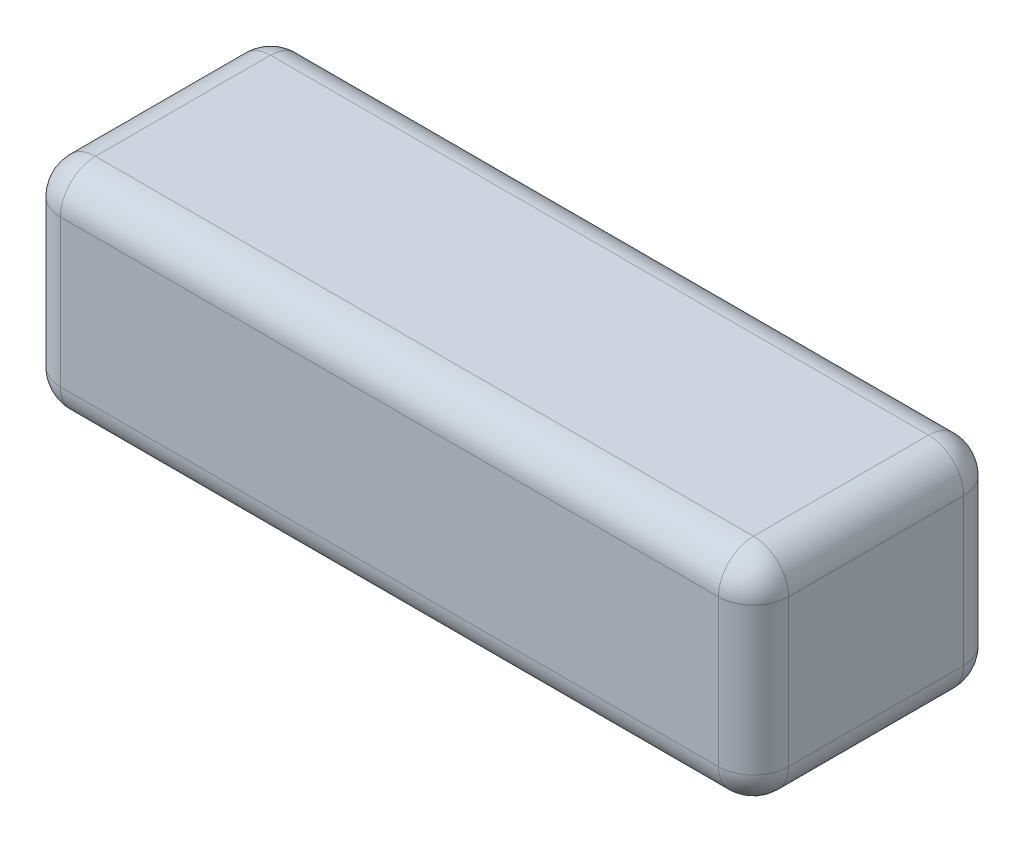
from build123d import *

# Parameters (mm, degrees)
SKETCH1_W           = 103.95
SKETCH1_H           = 35
BOSS_EXTRUDE1_DEPTH = 31
FILLET1_R           = 5


with BuildPart() as part:
    # Sketch1 → Boss-Extrude1 (new body)
    with BuildSketch(Plane(origin=(0, 0, 0), x_dir=(1, 0, 0), z_dir=(0, 1, 0))):
        Rectangle(SKETCH1_W, SKETCH1_H)
    extrude(amount=BOSS_EXTRUDE1_DEPTH)

    # Fillet1
    fillet1_edges = [part.edges().sort_by_distance(p)[0] for p in [
        (-51.975, 31, 0),
        (0, 31, 17.5),
        (51.975, 31, 0),
        (0, 0, 17.5),
        (-51.975, 0, 0),
        (0, 0, -17.5),
        (51.975, 0, 0),
        (0, 31, -17.5),
        (51.975, 15.5, 17.5),
        (-51.975, 15.5, 17.5),
        (-51.975, 15.5, -17.5),
        (51.975, 15.5, -17.5),
    ]]
    fillet(fillet1_edges, radius=FILLET1_R)


solid = part.part
